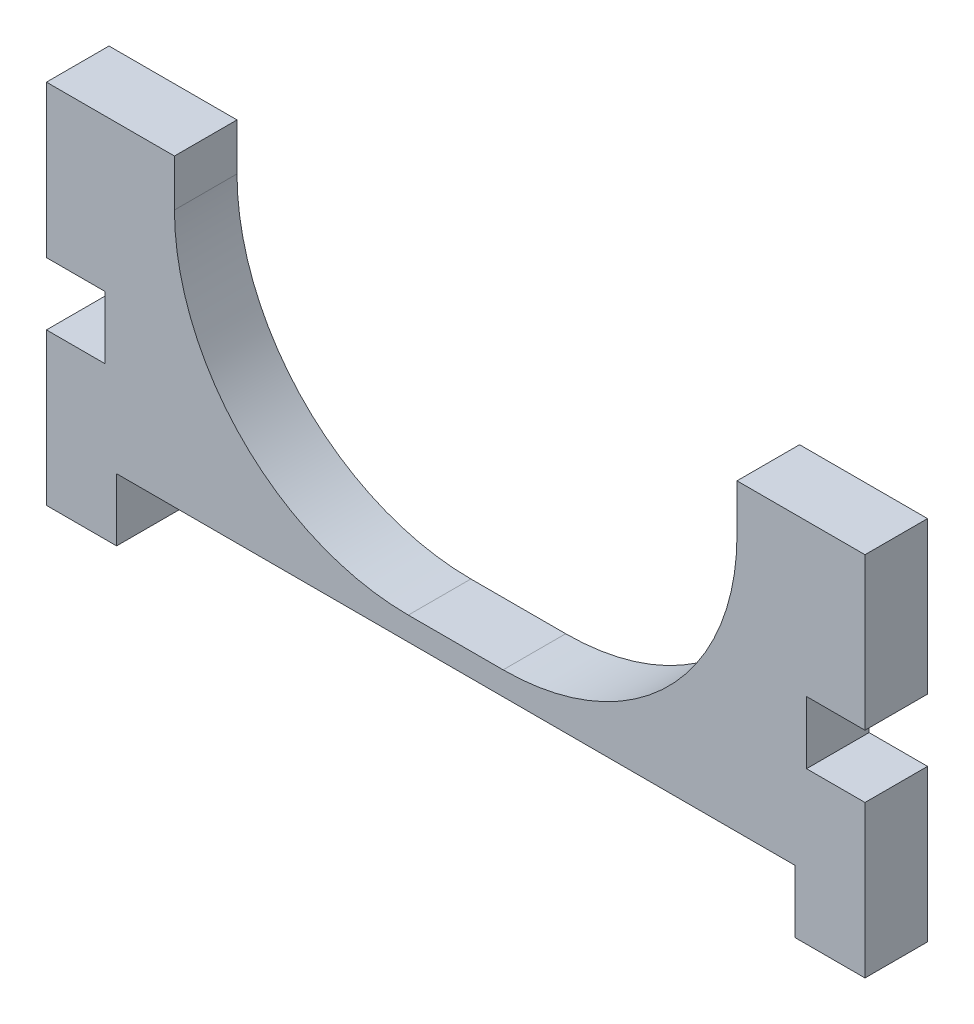
from build123d import *

# Parameters (mm, degrees)
BOSS_EXTRUDE1_DEPTH = 5.35


with BuildPart() as part:
    # Model → Boss-Extrude1 (new body)
    with BuildSketch(Plane.XY):
        with BuildLine():
            Line((-29, 0), (29, 0))
            Line((29, 0), (29, -5.35))
            Line((29, -5.35), (35, -5.35))
            Line((35, -5.35), (35, -2.50087083))
            Line((35, -2.50087083), (35, 7.65))
            Line((35, 7.65), (30, 7.65))
            Line((30, 7.65), (30, 13))
            Line((30, 13), (35, 13))
            Line((35, 13), (35, 26))
            Line((35, 26), (24.055, 26))
            Line((24.055, 26), (24.055, 22))
            ThreePointArc((24.055, 22), (18.197135624, 7.857864376), (4.055, 2))
            Line((4.055, 2), (-4.055, 2))
            ThreePointArc((-4.055, 2), (-18.197135624, 7.857864376), (-24.055, 22))
            Line((-24.055, 22), (-24.055, 26))
            Line((-24.055, 26), (-35, 26))
            Line((-35, 26), (-35, 13))
            Line((-35, 13), (-30, 13))
            Line((-30, 13), (-30, 7.65))
            Line((-30, 7.65), (-35, 7.65))
            Line((-35, 7.65), (-35, -2.50087083))
            Line((-35, -2.50087083), (-35, -5.35))
            Line((-35, -5.35), (-29, -5.35))
            Line((-29, -5.35), (-29, 0))
        make_face()
    extrude(amount=BOSS_EXTRUDE1_DEPTH)


solid = part.part
